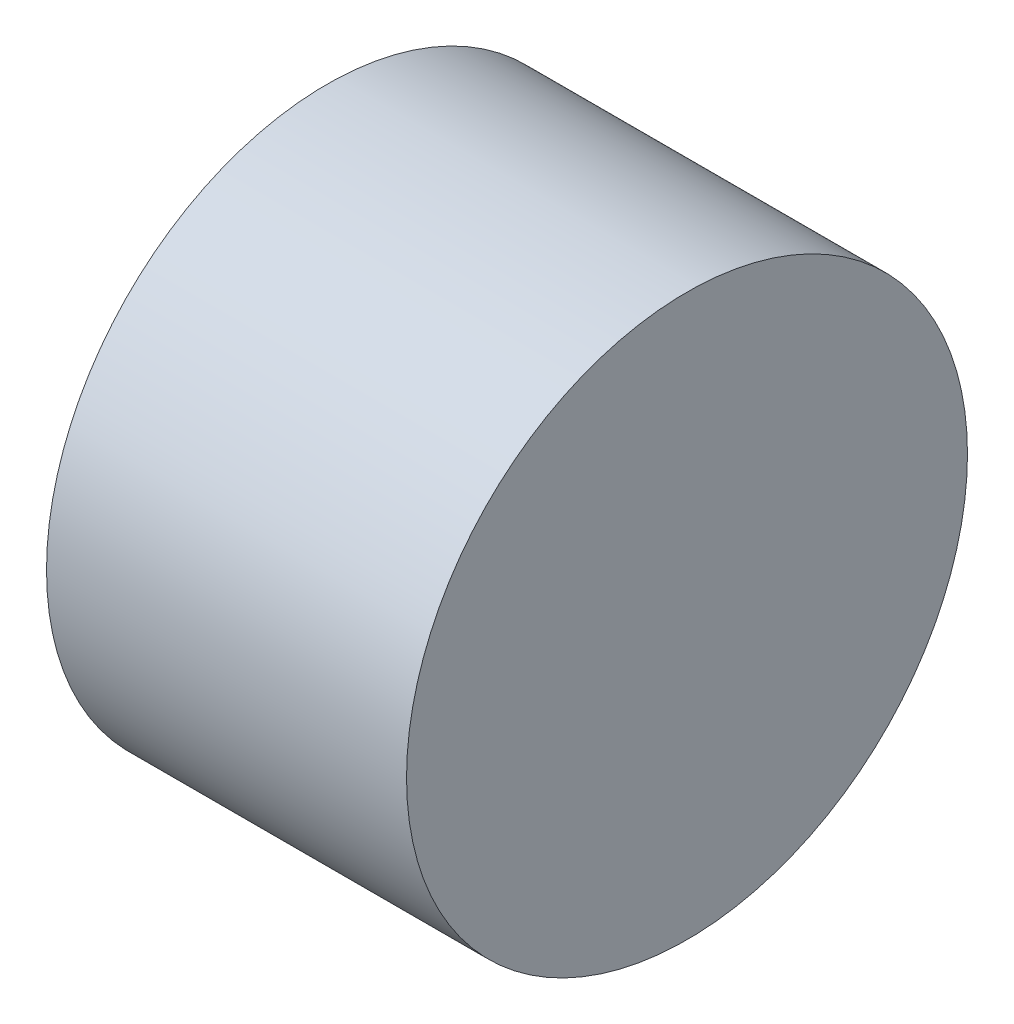
from build123d import *

# Parameters (mm, degrees)
SKETCH_5_R      = 16.75
EXTRUDE_4_DEPTH = 21.5


with BuildPart() as part:
    # 草图5 → 凸台-拉伸4 (new body)
    with BuildSketch(Plane(origin=(0, 0, 0), x_dir=(0, 0, -1), z_dir=(1, 0, 0))):
        Circle(SKETCH_5_R)
    extrude(amount=EXTRUDE_4_DEPTH)


solid = part.part
